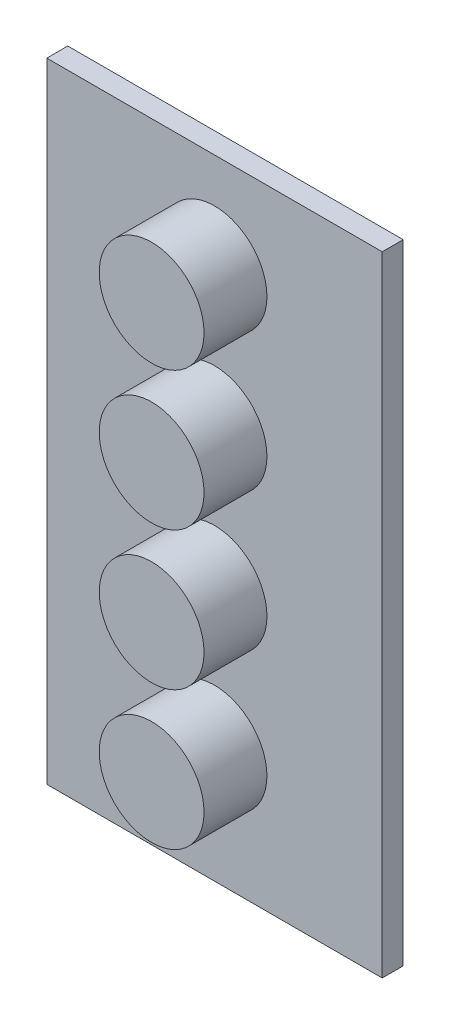
from build123d import *

# Parameters (mm, degrees)
SKETCH1_W           = 80
SKETCH1_H           = 150
BOSS_EXTRUDE1_DEPTH = 5
SKETCH2_R           = 12.5
BOSS_EXTRUDE2_DEPTH = 15


with BuildPart() as part:
    # Sketch1 → Boss-Extrude1 (new body)
    with BuildSketch(Plane.XY):
        Rectangle(SKETCH1_W, SKETCH1_H)
    extrude(amount=BOSS_EXTRUDE1_DEPTH)

    # Sketch2 → Boss-Extrude2 (add)
    with BuildSketch(Plane.XY.offset(5)):
        with Locations((0, 51.981235166)):
            Circle(SKETCH2_R)
        with Locations((0, 18.981235166)):
            Circle(SKETCH2_R)
        with Locations((0, -14.018764834)):
            Circle(SKETCH2_R)
        with Locations((0, -47.018764834)):
            Circle(SKETCH2_R)
    extrude(amount=BOSS_EXTRUDE2_DEPTH)


solid = part.part
